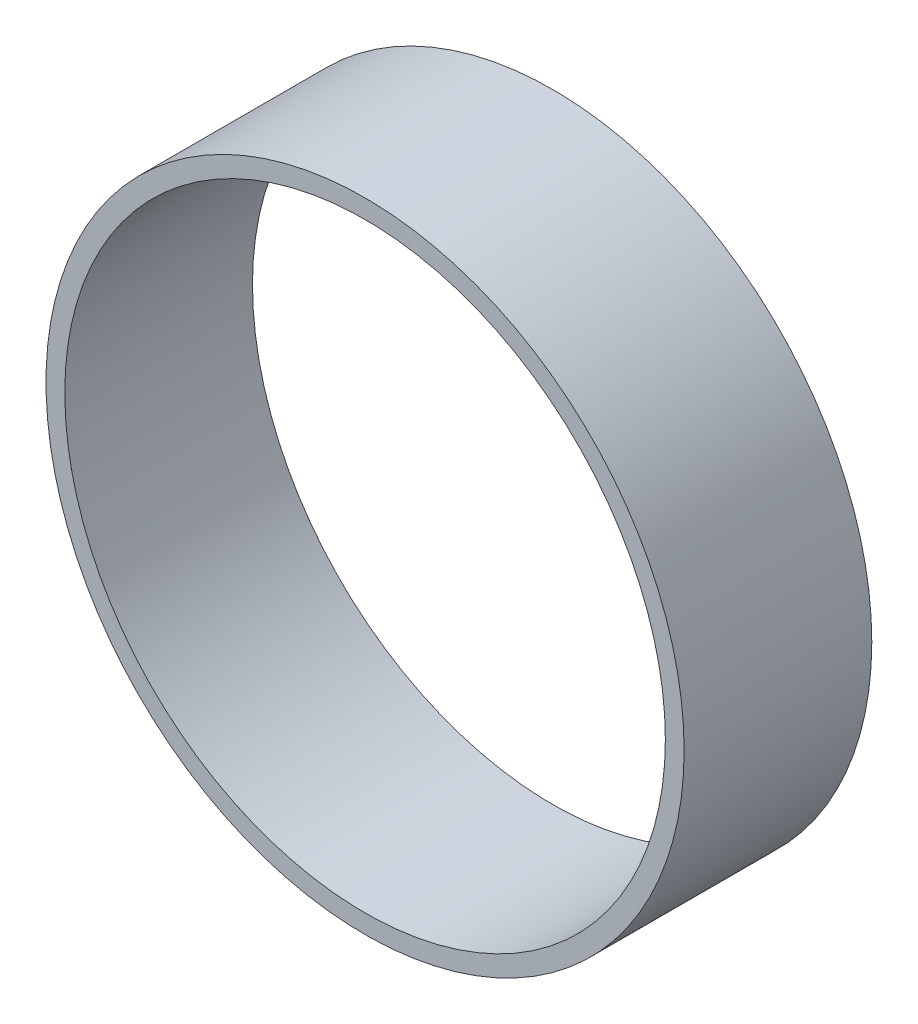
from build123d import *

# Parameters (mm, degrees)
SKETCH_1_R      = 8.5
SKETCH_1_R_2    = 8
EXTRUDE_1_DEPTH = 5


with BuildPart() as part:
    # 草图1 → 凸台-拉伸1 (new body)
    with BuildSketch(Plane.XY):
        Circle(SKETCH_1_R)
        Circle(SKETCH_1_R_2, mode=Mode.SUBTRACT)
    extrude(amount=EXTRUDE_1_DEPTH)


solid = part.part
